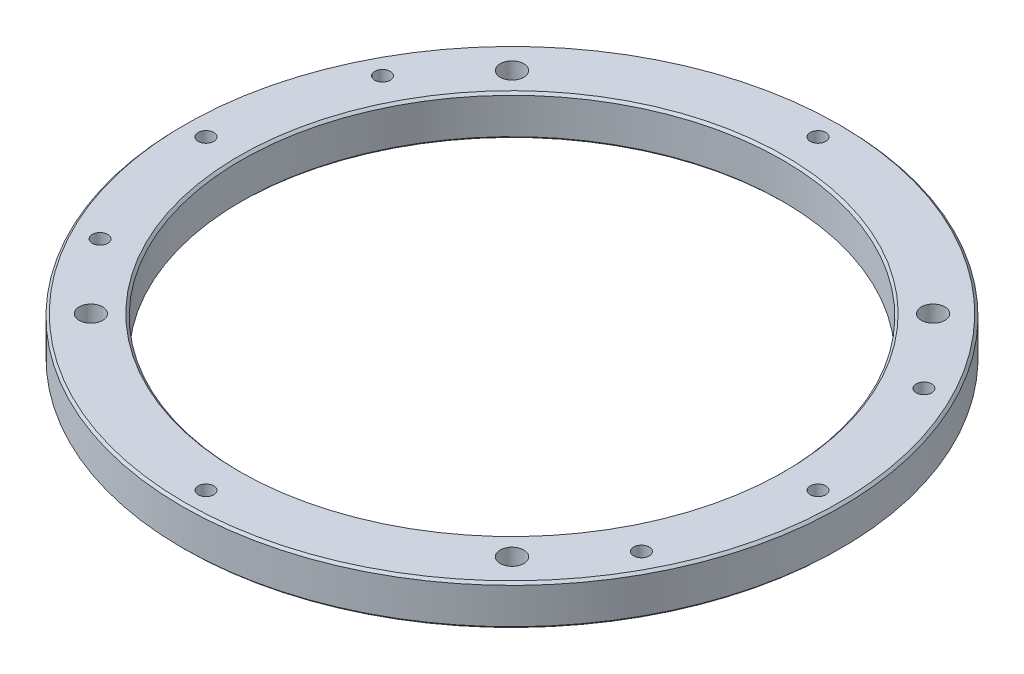
from build123d import *

# Parameters (mm, degrees)
SKETCH_1_R          = 70
SKETCH_1_R_2        = 57.5
EXTRUDE_1_DEPTH     = 8.6
SKETCH_2_R          = 2.5
CUT_EXTRUDE_1_DEPTH = 100.367801626
CHAMFER_1_SIZE      = 0.5
SKETCH_3_R          = 1.65
CUT_EXTRUDE_2_DEPTH = 100.367801626


with BuildPart() as part:
    # ｽｹｯﾁ1 → ﾎﾞｽ - 押し出し1 (new body)
    with BuildSketch(Plane(origin=(0, 0, 0), x_dir=(1, 0, 0), z_dir=(0, 1, 0))):
        with Locations(Location((0, 0, 0), (0, 0, 90))):
            Circle(SKETCH_1_R)
        with Locations(Location((0, 0, 0), (0, 0, 90))):
            Circle(SKETCH_1_R_2, mode=Mode.SUBTRACT)
    extrude(amount=EXTRUDE_1_DEPTH)

    # ｽｹｯﾁ2 → ｶｯﾄ - 押し出し1 (cut, through all)
    with BuildSketch(Plane(origin=(0, 8.6, 0), x_dir=(1, 0, 0), z_dir=(0, 1, 0))):
        with Locations(Location((-44.72450391, 44.72450391, 0), (0, 0, 270))):
            Circle(SKETCH_2_R)
        with Locations(Location((44.72450391, 44.72450391, 0), (0, 0, 270))):
            Circle(SKETCH_2_R)
        with Locations(Location((44.72450391, -44.72450391, 0), (0, 0, 270))):
            Circle(SKETCH_2_R)
        with Locations(Location((-44.72450391, -44.72450391, 0), (0, 0, 270))):
            Circle(SKETCH_2_R)
    extrude(amount=-CUT_EXTRUDE_1_DEPTH, mode=Mode.SUBTRACT)

    # 面取り1
    chamfer_1_edges = [part.edges().sort_by_distance(p)[0] for p in [
        (0, 0, 70),
        (0, 8.6, 70),
        (0, 0, 57.5),
        (0, 8.6, 57.5),
    ]]
    chamfer(chamfer_1_edges, length=CHAMFER_1_SIZE)

    # ｽｹｯﾁ3 → ｶｯﾄ - 押し出し2 (cut, through all)
    with BuildSketch(Plane(origin=(0, 8.6, 0), x_dir=(1, 0, 0), z_dir=(0, 1, 0))):
        with Locations(Location((65, 0, 0), (0, 0, 270))):
            Circle(SKETCH_3_R)
        with Locations(Location((0, -65, 0), (0, 0, 270))):
            Circle(SKETCH_3_R)
        with Locations(Location((-65, 0, 0), (0, 0, 270))):
            Circle(SKETCH_3_R)
        with Locations(Location((0, 65, 0), (0, 0, 270))):
            Circle(SKETCH_3_R)
        with Locations(Location((-57.5, 30, 0), (0, 0, 270))):
            Circle(SKETCH_3_R)
        with Locations(Location((57.5, 30, 0), (0, 0, 270))):
            Circle(SKETCH_3_R)
        with Locations(Location((57.5, -30, 0), (0, 0, 270))):
            Circle(SKETCH_3_R)
        with Locations(Location((-57.5, -30, 0), (0, 0, 270))):
            Circle(SKETCH_3_R)
    extrude(amount=-CUT_EXTRUDE_2_DEPTH, mode=Mode.SUBTRACT)


solid = part.part
